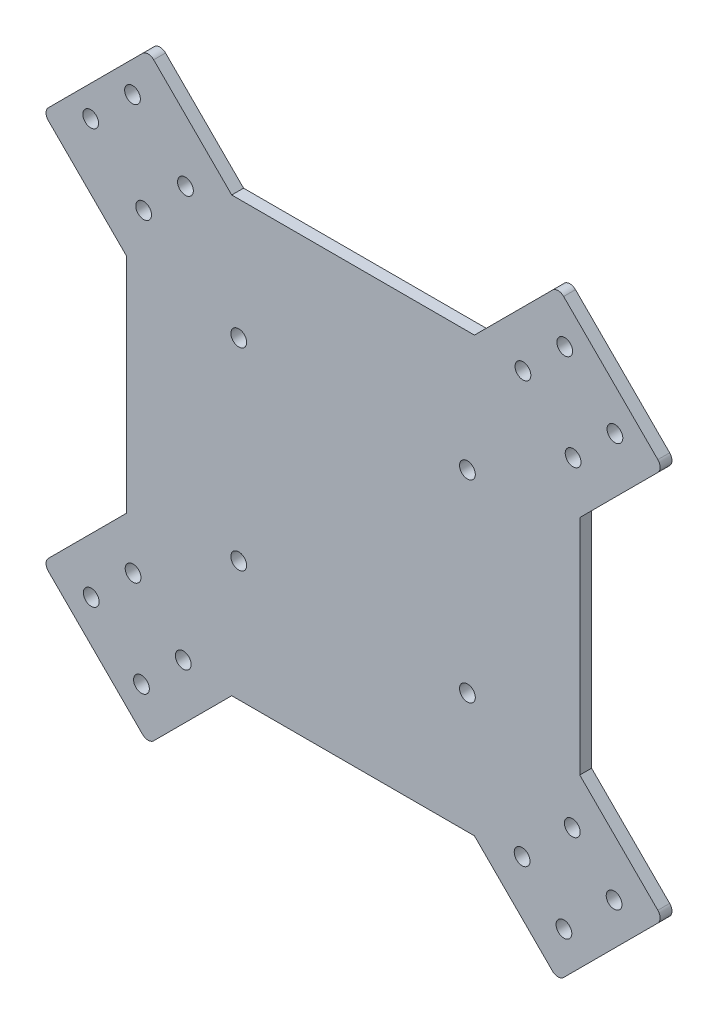
from build123d import *

# Parameters (mm, degrees)
SKETCH1_R           = 2
BOSS_EXTRUDE1_DEPTH = 3
SKETCH2_R           = 2
CUT_EXTRUDE1_DEPTH  = 110.604839186
FILLET1_R           = 2


with BuildPart() as part:
    # Sketch1 → Boss-Extrude1 (new body)
    with BuildSketch(Plane.XY):
        Polygon((78.713203436, 49.493203436), (57.5, 28.28), (57.5, -28.28), (78.713203436, -49.493203436), (51.993203436, -76.213203436), (30.78, -55), (-30.78, -55), (-51.993203436, -76.213203436), (-78.713203436, -49.493203436), (-57.5, -28.28), (-57.5, 28.28), (-78.713203436, 49.493203436), (-51.993203436, 76.213203436), (-30.78, 55), (30.78, 55), (51.993203436, 76.213203436), align=None)
        with Locations((29, -24.5)):
            Circle(SKETCH1_R, mode=Mode.SUBTRACT)
        with Locations((29, 24.5)):
            Circle(SKETCH1_R, mode=Mode.SUBTRACT)
        with Locations((-29, -24.5)):
            Circle(SKETCH1_R, mode=Mode.SUBTRACT)
        with Locations((-29, 24.5)):
            Circle(SKETCH1_R, mode=Mode.SUBTRACT)
    extrude(amount=BOSS_EXTRUDE1_DEPTH)

    # Sketch2 → Cut-Extrude1 (cut, through all)
    with BuildSketch(Plane.XY.offset(3)):
        with Locations((43.079339828, 53.30726189)):
            Circle(SKETCH2_R)
        with Locations((53.685941546, 63.913863607)):
            Circle(SKETCH2_R)
        with Locations((55.80726189, 40.579339828)):
            Circle(SKETCH2_R)
        with Locations((66.413863607, 51.185941546)):
            Circle(SKETCH2_R)
        with Locations((-66.413863607, -51.185941546)):
            Circle(SKETCH2_R)
        with Locations((-55.80726189, -40.579339828)):
            Circle(SKETCH2_R)
        with Locations((-43.079339828, -53.30726189)):
            Circle(SKETCH2_R)
        with Locations((-53.685941546, -63.913863607)):
            Circle(SKETCH2_R)
        with Locations((-55.948736265, 64.468991324)):
            Circle(SKETCH2_R)
        with Locations((-42.524212111, 51.044467171)):
            Circle(SKETCH2_R)
        with Locations((-53.130813829, 40.437865453)):
            Circle(SKETCH2_R)
        with Locations((-66.555337983, 53.862389606)):
            Circle(SKETCH2_R)
        with Locations((55.600435219, -40.786166499)):
            Circle(SKETCH2_R)
        with Locations((42.872513157, -53.51408856)):
            Circle(SKETCH2_R)
        with Locations((66.207036937, -51.392768217)):
            Circle(SKETCH2_R)
        with Locations((53.479114875, -64.120690278)):
            Circle(SKETCH2_R)
    extrude(amount=-CUT_EXTRUDE1_DEPTH, mode=Mode.SUBTRACT)

    # Fillet1
    fillet1_edges = [part.edges().sort_by_distance(p)[0] for p in [
        (78.713203436, -49.493203436, 1.5),
        (51.993203436, -76.213203436, 1.5),
        (-51.993203436, -76.213203436, 1.5),
        (-78.713203436, -49.493203436, 1.5),
        (-78.713203436, 49.493203436, 1.5),
        (-51.993203436, 76.213203436, 1.5),
        (51.993203436, 76.213203436, 1.5),
        (78.713203436, 49.493203436, 1.5),
    ]]
    fillet(fillet1_edges, radius=FILLET1_R)


solid = part.part
